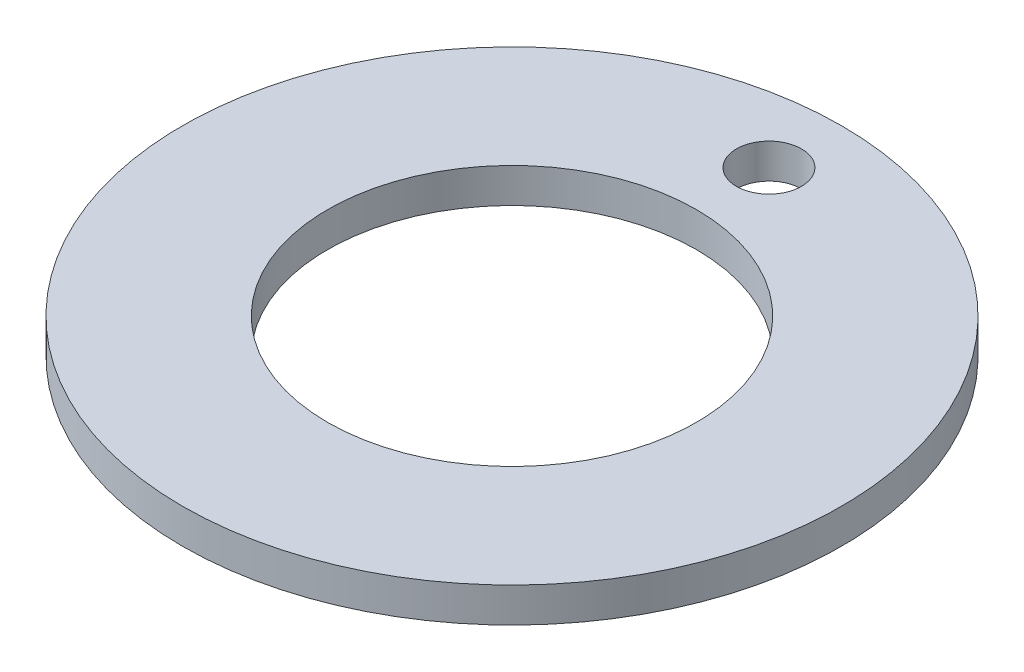
from build123d import *

# Parameters (mm, degrees)
SKETCH1_R           = 48.26
SKETCH1_R_2         = 27
SKETCH1_R_3         = 4.7625
BOSS_EXTRUDE1_DEPTH = 5.08


with BuildPart() as part:
    # Sketch1 → Boss-Extrude1 (new body)
    with BuildSketch(Plane(origin=(0, 0, 0), x_dir=(1, 0, 0), z_dir=(0, 1, 0))):
        with Locations(Location((0, 0, 0), (0, 0, 270))):
            Circle(SKETCH1_R)
        with Locations(Location((0, 0, 0), (0, 0, 270))):
            Circle(SKETCH1_R_2, mode=Mode.SUBTRACT)
        with Locations(Location((0, 37.63, 0), (0, 0, 270))):
            Circle(SKETCH1_R_3, mode=Mode.SUBTRACT)
    extrude(amount=BOSS_EXTRUDE1_DEPTH)


solid = part.part
